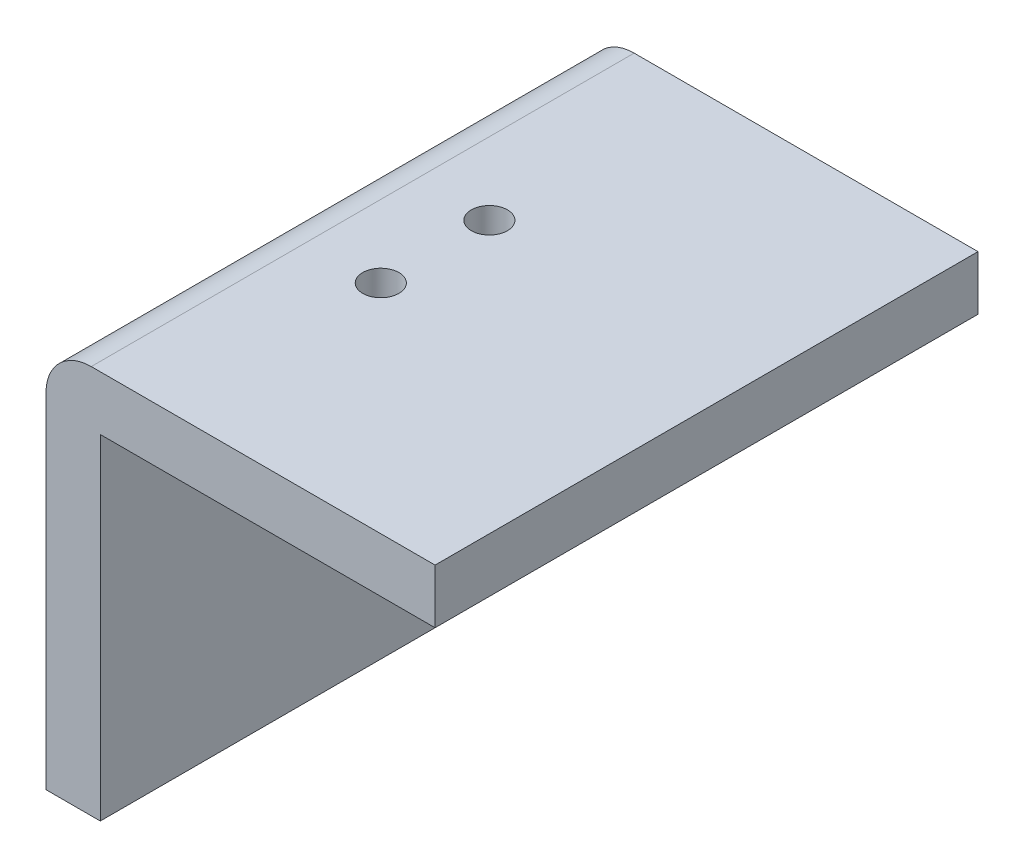
from build123d import *

# Parameters (mm, degrees)
BOSS_EXTRUDE1_DEPTH             = 30
F_2_0MM_CLEARANCE_DOWEL_HOLE1_D = 2


with BuildPart() as part:
    # Sketch1 → Boss-Extrude1 (new body)
    with BuildSketch(Plane.XY):
        with BuildLine():
            Line((0, 19), (0, 0))
            Line((0, 0), (1.5, 0))
            Line((1.5, 0), (1.5, 18.5))
            Line((1.5, 18.5), (20, 18.5))
            Line((20, 18.5), (20, 20))
            Line((20, 20), (1, 20))
            ThreePointArc((1, 20), (0.292893219, 19.707106781), (0, 19))
        make_face()
        with BuildLine():
            Line((-1.5, 0), (0, 0))
            Line((0, 0), (0, 19))
            ThreePointArc((0, 19), (0.292893219, 19.707106781), (1, 20))
            Line((1, 20), (20, 20))
            Line((20, 20), (20, 21.5))
            Line((20, 21.5), (1, 21.5))
            ThreePointArc((1, 21.5), (-0.767766953, 20.767766953), (-1.5, 19))
            Line((-1.5, 19), (-1.5, 0))
        make_face()
    extrude(amount=BOSS_EXTRUDE1_DEPTH)

    # Ø2.0mm Clearance Dowel Hole1 (through all)
    with Locations(Plane(origin=(-21.929397557, 18.5, -58.5), x_dir=(-1, 0, 0), z_dir=(0, -1, 0))):
        with Locations((-26.929397557, -76.5), (-26.929397557, -70.5)):
            Hole(F_2_0MM_CLEARANCE_DOWEL_HOLE1_D / 2)


solid = part.part
